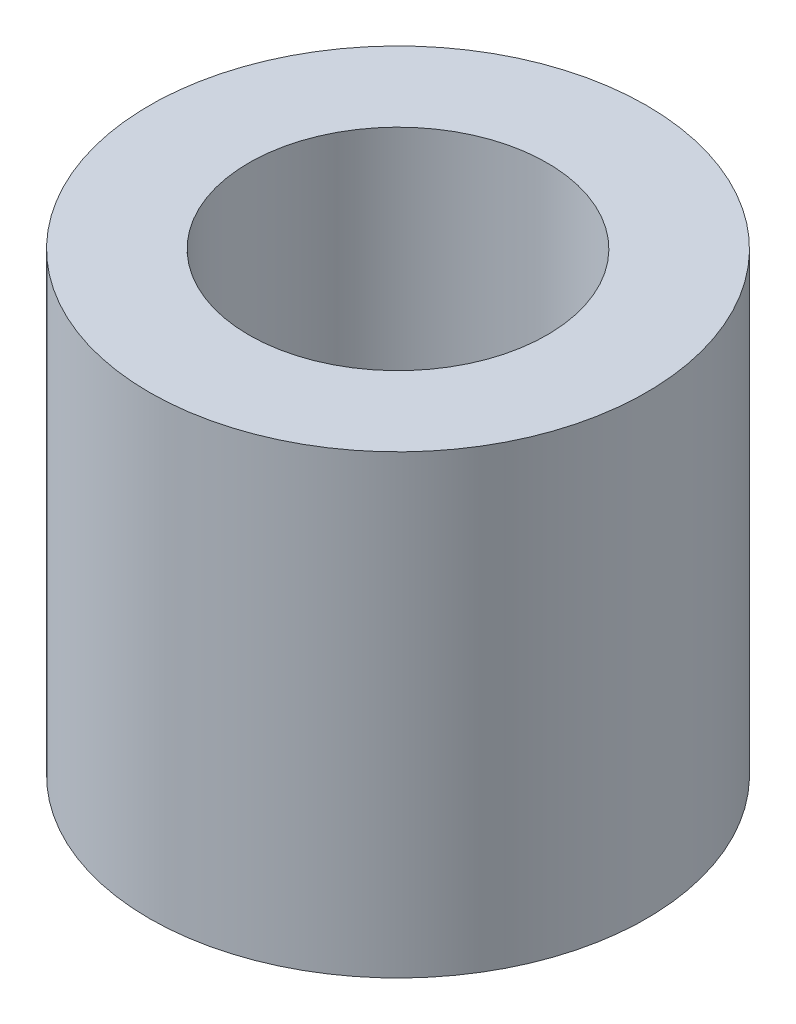
from build123d import *

# Parameters (mm, degrees)
SKETCH1_R           = 3
SKETCH1_R_2         = 1.8
BOSS_EXTRUDE1_DEPTH = 5.5


with BuildPart() as part:
    # Sketch1 → Boss-Extrude1 (new body)
    with BuildSketch(Plane(origin=(0, 0, 0), x_dir=(1, 0, 0), z_dir=(0, 1, 0))):
        with Locations(Location((0, 0, 0), (0, 0, 270))):
            Circle(SKETCH1_R)
        with Locations(Location((0, 0, 0), (0, 0, 270))):
            Circle(SKETCH1_R_2, mode=Mode.SUBTRACT)
    extrude(amount=BOSS_EXTRUDE1_DEPTH)


solid = part.part
